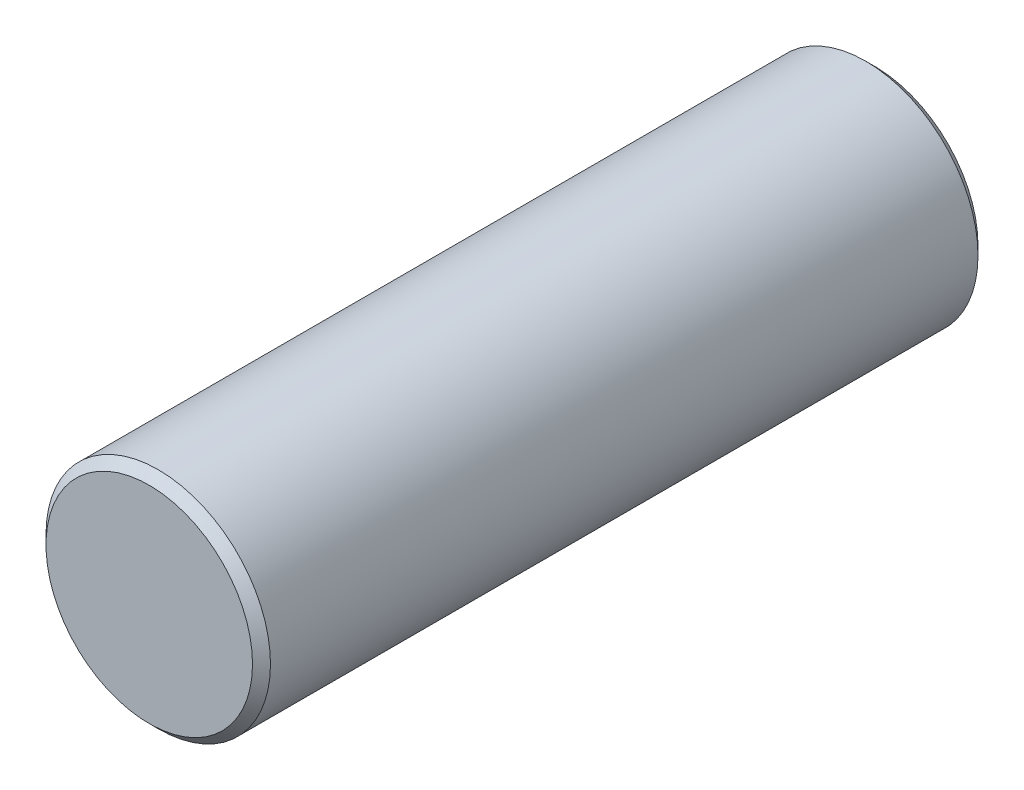
from build123d import *

# Parameters (mm, degrees)
SKETCH1_R           = 2.5
BOSS_EXTRUDE1_DEPTH = 8.08
CHAMFER1_SIZE       = 0.2


with BuildPart() as part:
    # Sketch1 → Boss-Extrude1 (new, symmetric)
    with BuildSketch(Plane.XY):
        Circle(SKETCH1_R)
    extrude(amount=BOSS_EXTRUDE1_DEPTH, both=True)

    # Chamfer1
    chamfer1_edges = [part.edges().sort_by_distance(p)[0] for p in [
        (-2.5, 0, -8.08),
        (-2.5, 0, 8.08),
    ]]
    chamfer(chamfer1_edges, length=CHAMFER1_SIZE)


solid = part.part
